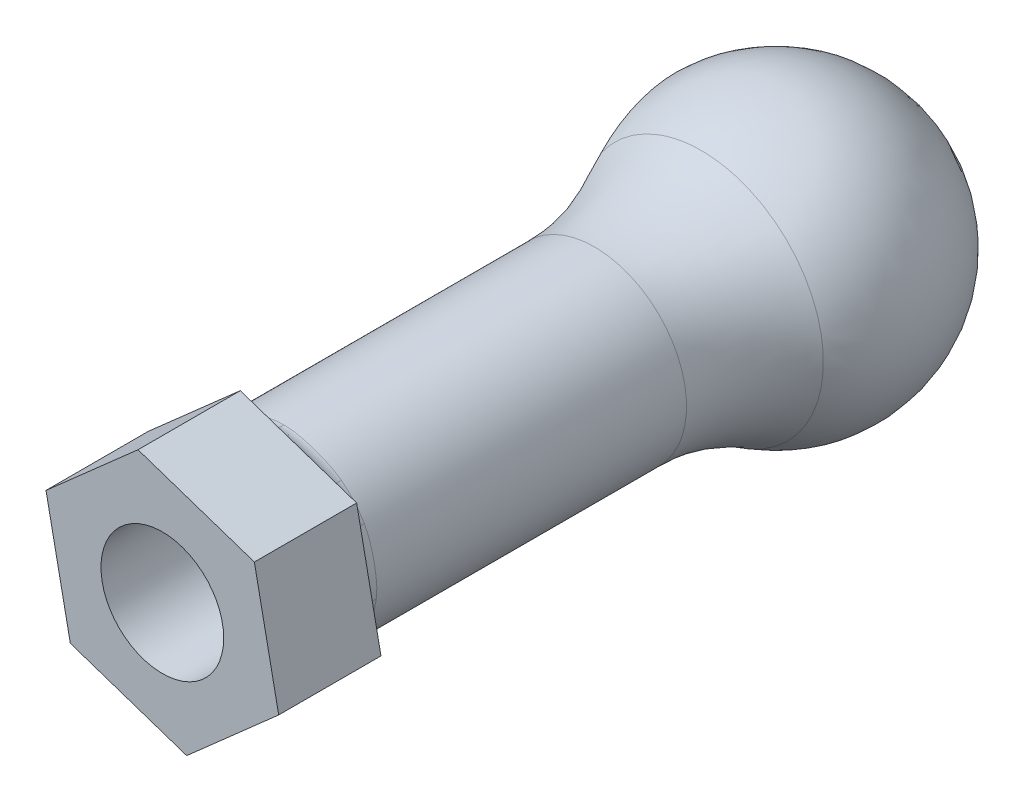
from build123d import *

# Parameters (mm, degrees)
SKETCH2_R           = 4.5
BOSS_EXTRUDE1_DEPTH = 25
BOSS_EXTRUDE2_DEPTH = 5
SKETCH4_R           = 3
CUT_EXTRUDE1_DEPTH  = 20
FILLET1_R           = 10
FILLET3_R           = 1
SKETCH6_R           = 5
CUT_EXTRUDE2_DEPTH  = 20


with BuildPart() as part:
    # Sketch1 → Revolve1 (revolve)
    with BuildSketch(Plane.XY):
        with BuildLine():
            Line((0, 7), (0, -7))
            ThreePointArc((0, -7), (7, 0), (0, 7))
        make_face()
    revolve(axis=Axis((0, 7, 0), (0, -1, 0)))

    # Sketch2 → Boss-Extrude1 (add)
    with BuildSketch(Plane.XY):
        with Locations(Location((0, 0, 0), (0, 0, 180))):
            Circle(SKETCH2_R)
    extrude(amount=BOSS_EXTRUDE1_DEPTH)

    # Sketch3 → Boss-Extrude2 (add)
    with BuildSketch(Plane.XY.offset(25)):
        Polygon((5.687720884, -1.910453125), (4.498361381, 3.970484213), (-1.189359503, 5.880937338), (-5.687720884, 1.910453125), (-4.498361381, -3.970484213), (1.189359503, -5.880937338), align=None)
    extrude(amount=BOSS_EXTRUDE2_DEPTH)

    # Sketch4 → Cut-Extrude1 (cut)
    with BuildSketch(Plane.XY.offset(30)):
        Circle(SKETCH4_R)
    extrude(amount=-CUT_EXTRUDE1_DEPTH, mode=Mode.SUBTRACT)

    # Fillet1
    fillet1_edges = [part.edges().sort_by_distance(p)[0] for p in [
        (4.5, 0, 5.361902647),
    ]]
    fillet(fillet1_edges, radius=FILLET1_R)

    # Fillet3
    fillet3_edges = [part.edges().sort_by_distance(p)[0] for p in [
        (4.5, 0, 25),
    ]]
    fillet(fillet3_edges, radius=FILLET3_R)

    # Sketch5 → Cut-Revolve1 (revolve, cut)
    with BuildSketch(Plane(origin=(0, 0, 0), x_dir=(0, 0, -1), z_dir=(1, 0, 0))):
        with BuildLine():
            Line((6, 0), (-6, 0))
            ThreePointArc((-6, 0), (0, -6), (6, 0))
        make_face()
    revolve(axis=Axis((0, 0, -6), (0, 0, 1)), mode=Mode.SUBTRACT)

    # Sketch6 → Cut-Extrude2 (cut)
    with BuildSketch(Plane(origin=(0, 0, 0), x_dir=(0, 0, -1), z_dir=(1, 0, 0))):
        Circle(SKETCH6_R)
    extrude(amount=-CUT_EXTRUDE2_DEPTH, mode=Mode.SUBTRACT)


solid = part.part
